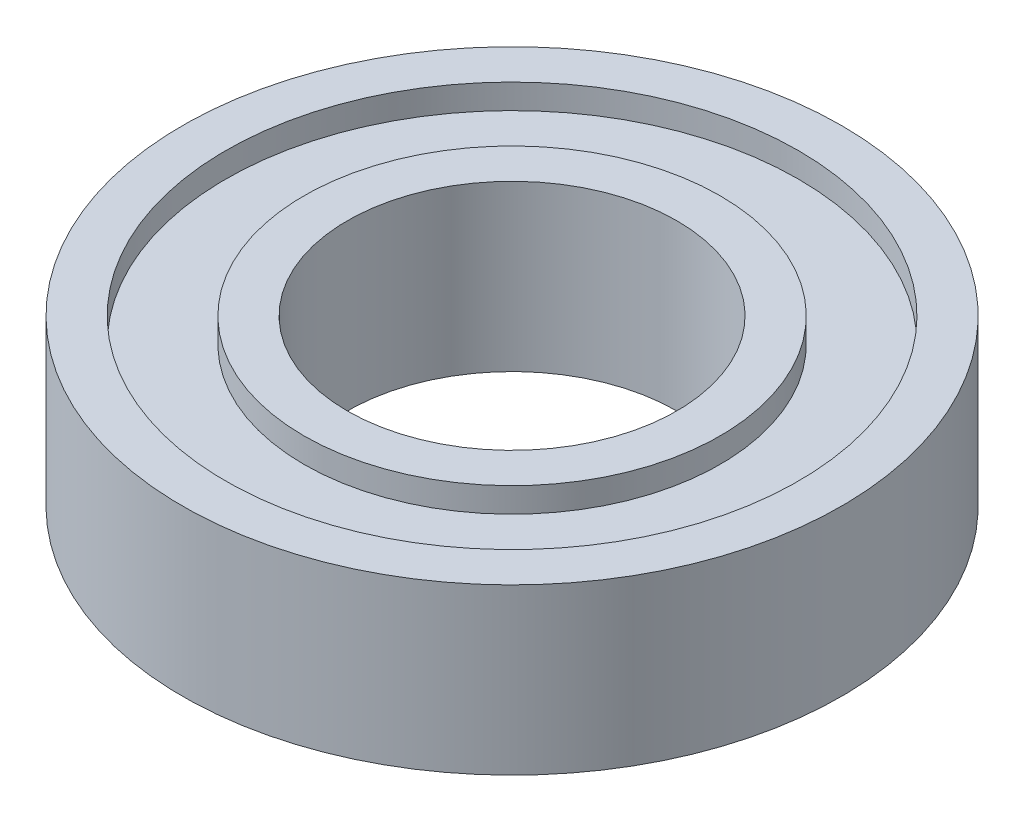
from build123d import *


with BuildPart() as part:
    # Sketch1 → Revolve1 (revolve)
    with BuildSketch(Plane.XY, mode=Mode.PRIVATE) as revolve1_sk:
        Polygon((4, 0), (4, 4), (5.05, 4), (5.05, 3.4), (6.95, 3.4), (6.95, 4), (8, 4), (8, 0), (6.95, 0), (6.95, 0.6), (5.05, 0.6), (5.05, 0), align=None)
    revolve(revolve1_sk.sketch.rotate(Axis((0, 0, 0), (0, 1, 0)), 90), axis=Axis((0, 0, 0), (0, 1, 0)))


solid = part.part
